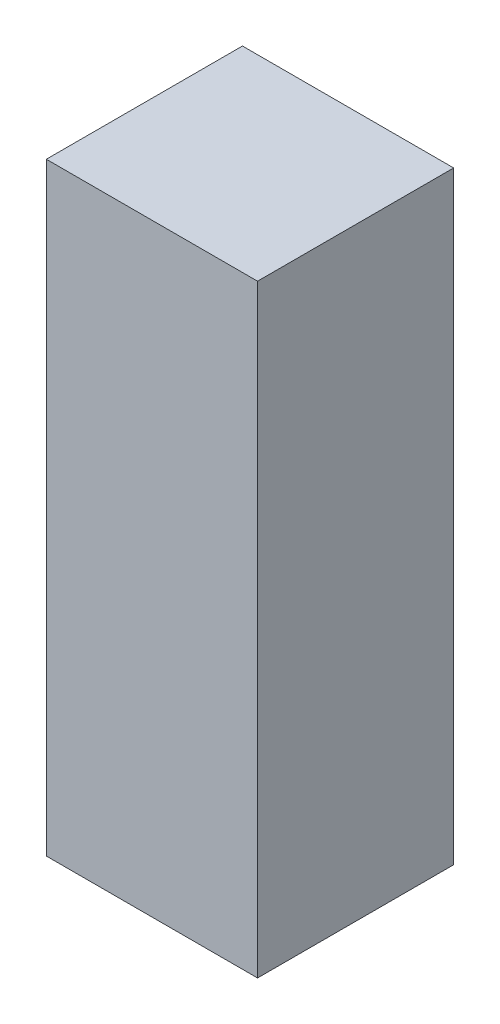
from build123d import *

# Parameters (mm, degrees)
OVEN_YAG_KABI_KAPAGI_MENTESE_1_1_START = 20
SKETCH1_W                              = 14
SKETCH1_H                              = 40
OVEN_YAG_KABI_KAPAGI_MENTESE_1_1_DEPTH = 13


with BuildPart() as part:
    # Sketch1 → OVEN_yag_kabi_kapagi_mentese_1_1 (new body)
    with BuildSketch(Plane.XY.offset(OVEN_YAG_KABI_KAPAGI_MENTESE_1_1_START)):
        with Locations((31, 880)):
            Rectangle(SKETCH1_W, SKETCH1_H)
    extrude(amount=OVEN_YAG_KABI_KAPAGI_MENTESE_1_1_DEPTH)


solid = part.part
